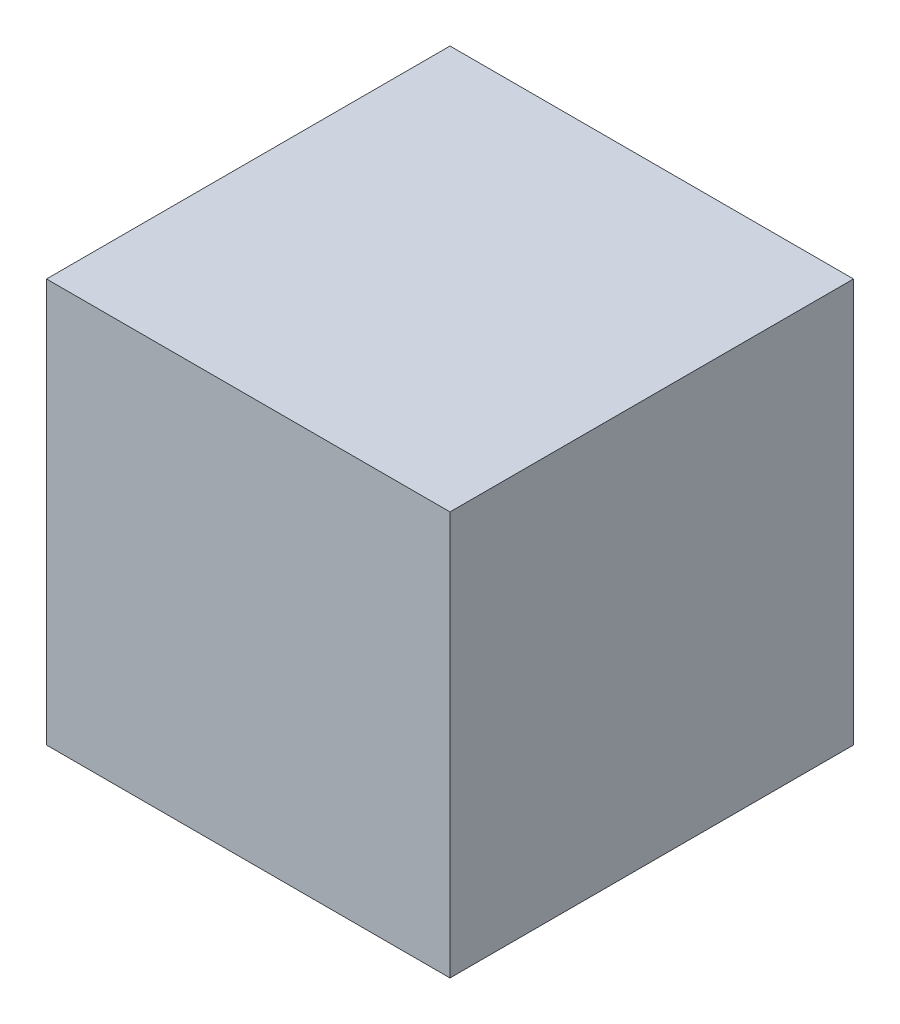
from build123d import *

# Parameters (mm, degrees)
SKETCH1_W           = 253.9
SKETCH1_H           = 253.9
BOSS_EXTRUDE1_DEPTH = 254
SKETCH3_W           = 254.1
SKETCH3_H           = 254.1
BOSS_EXTRUDE2_DEPTH = 0.1
SKETCH4_W           = 254.1
SKETCH4_H           = 254.1
BOSS_EXTRUDE3_DEPTH = 0.1


with BuildPart() as part:
    # Sketch1 → Boss-Extrude1 (new body)
    with BuildSketch(Plane(origin=(0, 0, 0), x_dir=(1, 0, 0), z_dir=(0, 1, 0))):
        Polygon((-127, 127.1), (127, 127.1), (127.1, 127.1), (127.1, 127), (127.1, -127), (127, -127), (-127, -127), (-127, 127), align=None)
        with Locations((0.05, 0.05)):
            Rectangle(SKETCH1_W, SKETCH1_H, mode=Mode.SUBTRACT)
    extrude(amount=BOSS_EXTRUDE1_DEPTH)

    # Sketch3 → Boss-Extrude2 (add)
    with BuildSketch(Plane(origin=(0, 254, 0), x_dir=(1, 0, 0), z_dir=(0, 1, 0))):
        with Locations((0.05, 0.05)):
            Rectangle(SKETCH3_W, SKETCH3_H)
    extrude(amount=BOSS_EXTRUDE2_DEPTH)

    # Sketch4 → Boss-Extrude3 (add)
    with BuildSketch(Plane.XZ):
        with Locations((0.05, -0.05)):
            Rectangle(SKETCH4_W, SKETCH4_H)
    extrude(amount=BOSS_EXTRUDE3_DEPTH)


solid = part.part
